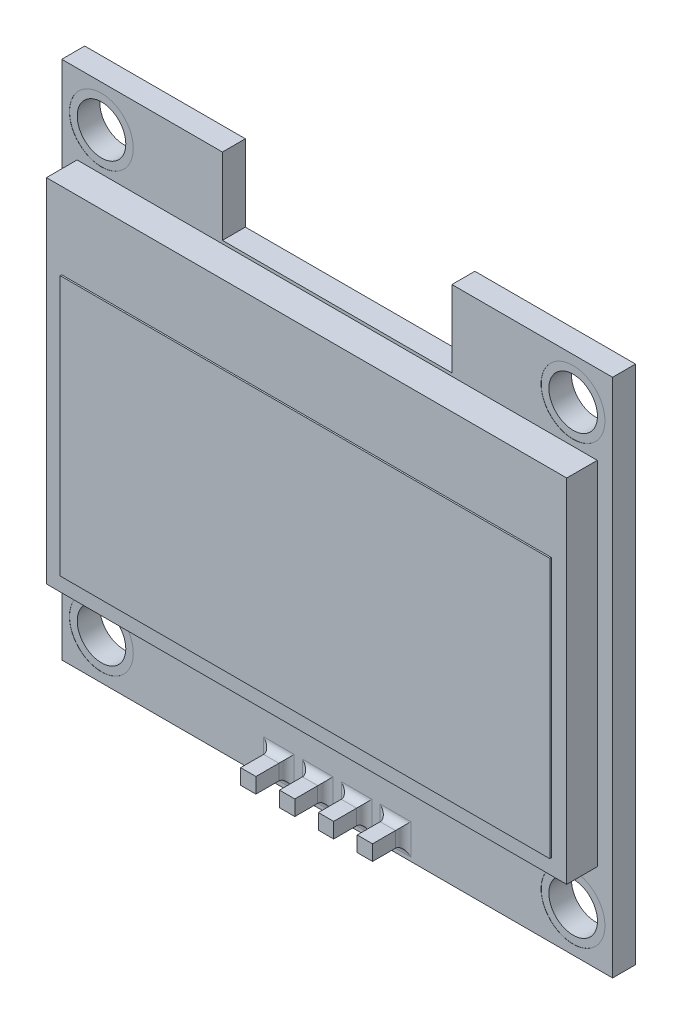
from build123d import *

# Parameters (mm, degrees)
CROQUIS1_W                   = 36
CROQUIS1_H                   = 34
SALIENTE_EXTRUIR1_DEPTH      = 1.5
CROQUIS2_W                   = 15
CROQUIS2_H                   = 5
CORTAR_EXTRUIR1_DEPTH        = 1.5
CROQUIS3_R                   = 1.5875
CORTAR_EXTRUIR2_DEPTH        = 2.54
CROQUIS4_W                   = 34
CROQUIS4_H                   = 23
SALIENTE_EXTRUIR2_DEPTH      = 2
CROQUIS5_W                   = 32
CROQUIS5_H                   = 17
SALIENTE_EXTRUIR5_DEPTH      = 0.1
SALIENTE_EXTRUIR7_DEPTH      = 2
SALIENTE_EXTRUIR7_DEPTH_BACK = 10
CROQUIS15_W                  = 1
CROQUIS15_H                  = 1
CROQUIS16_W                  = 2
CROQUIS16_H                  = 2
SALIENTE_EXTRUIR8_DEPTH      = 2
CROQUIS17_W                  = 9.62
CROQUIS17_H                  = 1.5
SALIENTE_EXTRUIR9_DEPTH      = 2
REDONDEO1_R                  = 0.5
CROQUIS41_R                  = 2.0875
CORTAR_EXTRUIR4_DEPTH        = 0.01
CORTAR_EXTRUIR5_START        = -0.01
CROQUIS42_R                  = 2.0875
CORTAR_EXTRUIR5_DEPTH        = 0.01


with BuildPart() as part:
    # Croquis1 → Saliente-Extruir1 (new body)
    with BuildSketch(Plane.XY):
        Rectangle(CROQUIS1_W, CROQUIS1_H)
    extrude(amount=SALIENTE_EXTRUIR1_DEPTH)

    # Croquis2 → Cortar-Extruir1 (cut)
    with BuildSketch(Plane.XY.offset(1.5)):
        with Locations((0, 14.5)):
            Rectangle(CROQUIS2_W, CROQUIS2_H)
    extrude(amount=-CORTAR_EXTRUIR1_DEPTH, mode=Mode.SUBTRACT)

    # Croquis3 → Cortar-Extruir2 (cut)
    with BuildSketch(Plane.XY.offset(1.5)):
        with Locations((-15.4125, 14.2875)):
            Circle(CROQUIS3_R)
        with Locations((15.4125, 14.2875)):
            Circle(CROQUIS3_R)
        with Locations((15.4125, -14.2875)):
            Circle(CROQUIS3_R)
        with Locations((-15.4125, -14.2875)):
            Circle(CROQUIS3_R)
    extrude(amount=-CORTAR_EXTRUIR2_DEPTH, mode=Mode.SUBTRACT)

    # Croquis4 → Saliente-Extruir2 (add)
    with BuildSketch(Plane.XY.offset(1.5)):
        with Locations((0, 0.3)):
            Rectangle(CROQUIS4_W, CROQUIS4_H)
    extrude(amount=SALIENTE_EXTRUIR2_DEPTH)

    # Croquis5 → Saliente-Extruir5 (add)
    with BuildSketch(Plane.XY.offset(3.5)):
        with Locations((0, -1.7)):
            Rectangle(CROQUIS5_W, CROQUIS5_H)
    extrude(amount=SALIENTE_EXTRUIR5_DEPTH)

    # Croquis15 → Saliente-Extruir7 (add, two sides: drawn at the far end of the back side and taken through both)
    with BuildSketch(Plane.XY.offset(1.5).offset(-SALIENTE_EXTRUIR7_DEPTH_BACK)):
        with Locations((1.27, -15.75)):
            Rectangle(CROQUIS15_W, CROQUIS15_H)
        with Locations((3.81, -15.75)):
            Rectangle(CROQUIS15_W, CROQUIS15_H)
        with Locations((-1.27, -15.75)):
            Rectangle(CROQUIS15_W, CROQUIS15_H)
        with Locations((-3.81, -15.75)):
            Rectangle(CROQUIS15_W, CROQUIS15_H)
    extrude(amount=SALIENTE_EXTRUIR7_DEPTH + SALIENTE_EXTRUIR7_DEPTH_BACK)

    # Croquis16 → Saliente-Extruir8 (add)
    with BuildSketch(Plane(origin=(0, 0, 0), x_dir=(-1, 0, 0), z_dir=(0, 0, -1))):
        with Locations((3.81, -15.75)):
            Rectangle(CROQUIS16_W, CROQUIS16_H)
        with Locations((1.27, -15.75)):
            Rectangle(CROQUIS16_W, CROQUIS16_H)
        with Locations((-1.27, -15.75)):
            Rectangle(CROQUIS16_W, CROQUIS16_H)
        with Locations((-3.81, -15.75)):
            Rectangle(CROQUIS16_W, CROQUIS16_H)
    extrude(amount=SALIENTE_EXTRUIR8_DEPTH)

    # Croquis17 → Saliente-Extruir9 (add)
    with BuildSketch(Plane(origin=(0, 0, 0), x_dir=(-1, 0, 0), z_dir=(0, 0, -1))):
        with Locations((0, -15.75)):
            Rectangle(CROQUIS17_W, CROQUIS17_H)
    extrude(amount=SALIENTE_EXTRUIR9_DEPTH)

    # Redondeo1
    redondeo1_edges = [part.edges().sort_by_distance(p)[0] for p in [
        (0.77, -15.75, 1.5),
        (1.27, -15.25, 1.5),
        (1.77, -15.75, 1.5),
        (1.27, -16.25, 1.5),
        (-1.77, -15.75, 1.5),
        (-1.27, -15.25, 1.5),
        (-0.77, -15.75, 1.5),
        (-1.27, -16.25, 1.5),
        (-4.31, -15.75, 1.5),
        (-3.81, -15.25, 1.5),
        (-3.31, -15.75, 1.5),
        (-3.81, -16.25, 1.5),
        (3.31, -15.75, 1.5),
        (3.81, -15.25, 1.5),
        (4.31, -15.75, 1.5),
        (3.81, -16.25, 1.5),
    ]]
    fillet(redondeo1_edges, radius=REDONDEO1_R)

    # Croquis41 → Cortar-Extruir4 (cut)
    with BuildSketch(Plane.XY.offset(1.5)):
        with Locations((-15.4125, 14.2875)):
            Circle(CROQUIS41_R)
        with Locations((15.4125, 14.2875)):
            Circle(CROQUIS41_R)
        with Locations((15.4125, -14.2875)):
            Circle(CROQUIS41_R)
        with Locations((-15.4125, -14.2875)):
            Circle(CROQUIS41_R)
    extrude(amount=-CORTAR_EXTRUIR4_DEPTH, mode=Mode.SUBTRACT)

    # Croquis42 → Cortar-Extruir5 (cut)
    with BuildSketch(Plane(origin=(0, 0, 0), x_dir=(-1, 0, 0), z_dir=(0, 0, -1)).offset(CORTAR_EXTRUIR5_START)):
        with Locations(Location((-15.4125, 14.2875, 0), (0, 0, 180))):
            Circle(CROQUIS42_R)
        with Locations(Location((15.4125, 14.2875, 0), (0, 0, 180))):
            Circle(CROQUIS42_R)
        with Locations(Location((15.4125, -14.2875, 0), (0, 0, 180))):
            Circle(CROQUIS42_R)
        with Locations(Location((-15.4125, -14.2875, 0), (0, 0, 180))):
            Circle(CROQUIS42_R)
    extrude(amount=CORTAR_EXTRUIR5_DEPTH, mode=Mode.SUBTRACT)


solid = part.part
